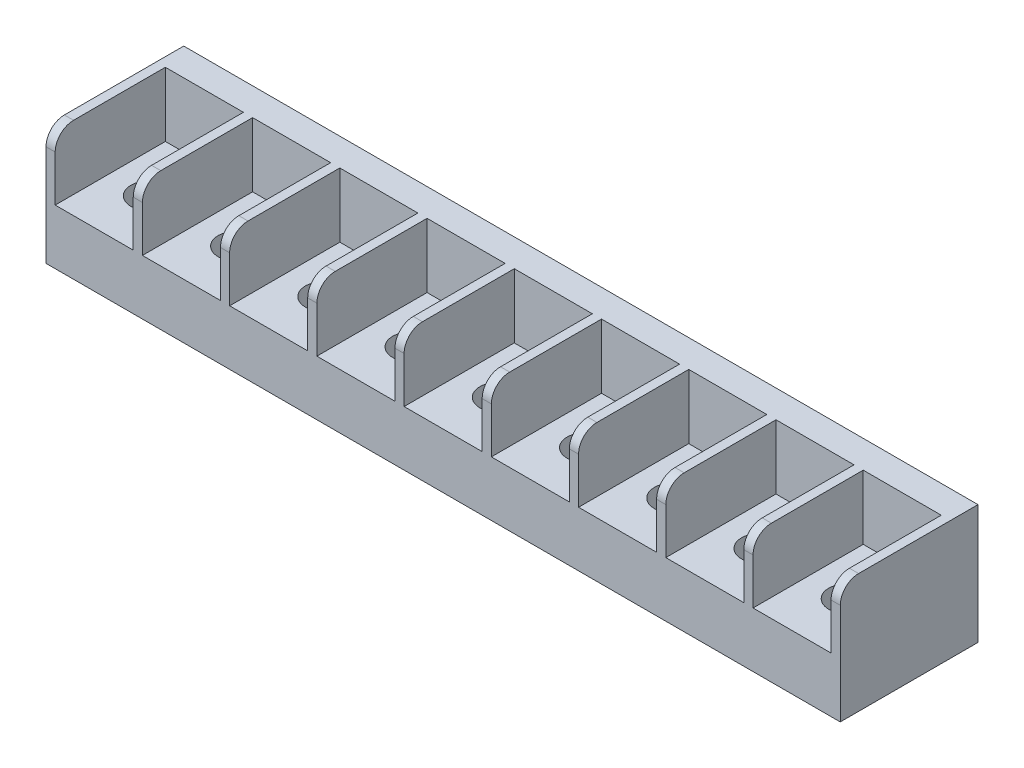
from build123d import *

# Parameters (mm, degrees)
SKETCH3_W           = 86.5
SKETCH3_H           = 15
BOSS_EXTRUDE1_DEPTH = 13
SKETCH4_W           = 8.5
SKETCH4_H           = 12
CUT_EXTRUDE1_DEPTH  = 7
LPATTERN1_COUNT     = 9
LPATTERN1_PITCH     = 9.5
FILLET1_R           = 2
SKETCH5_R           = 2
CUT_EXTRUDE2_DEPTH  = 89.069574769
LPATTERN2_COUNT     = 9
LPATTERN2_PITCH     = 9.5


with BuildPart() as part:
    # Sketch3 → Boss-Extrude1 (new body)
    with BuildSketch(Plane(origin=(0, 0, 0), x_dir=(1, 0, 0), z_dir=(0, 1, 0))):
        with Locations((43.25, 7.5)):
            Rectangle(SKETCH3_W, SKETCH3_H)
    extrude(amount=BOSS_EXTRUDE1_DEPTH)

    # Sketch4 → Cut-Extrude1 (cut)
    with BuildSketch(Plane(origin=(0, 13, 0), x_dir=(1, 0, 0), z_dir=(0, 1, 0))):
        with Locations((5.25, 6)):
            Rectangle(SKETCH4_W, SKETCH4_H)
    cut_extrude1 = extrude(amount=-CUT_EXTRUDE1_DEPTH, mode=Mode.SUBTRACT)

    # LPattern1: Cut-Extrude1 ×9
    with Locations(*[(i * LPATTERN1_PITCH, 0, 0) for i in range(1, LPATTERN1_COUNT)]):
        add(cut_extrude1, mode=Mode.SUBTRACT)

    # Fillet1
    fillet1_edges = [part.edges().sort_by_distance(p)[0] for p in [
        (76.5, 13, 0),
        (86, 13, 0),
        (10, 13, 0),
        (19.5, 13, 0),
        (29, 13, 0),
        (38.5, 13, 0),
        (48, 13, 0),
        (0.5, 13, 0),
        (57.5, 13, 0),
        (67, 13, 0),
    ]]
    fillet(fillet1_edges, radius=FILLET1_R)

    # Sketch5 → Cut-Extrude2 (cut, through all)
    with BuildSketch(Plane(origin=(0, 6, 0), x_dir=(1, 0, 0), z_dir=(0, 1, 0))):
        with Locations(Location((5.25, 6, 0), (0, 0, 270))):
            Circle(SKETCH5_R)
    cut_extrude2 = extrude(amount=-CUT_EXTRUDE2_DEPTH, mode=Mode.SUBTRACT)

    # LPattern2: Cut-Extrude2 ×9
    with Locations(*[(i * LPATTERN2_PITCH, 0, 0) for i in range(1, LPATTERN2_COUNT)]):
        add(cut_extrude2, mode=Mode.SUBTRACT)


solid = part.part
